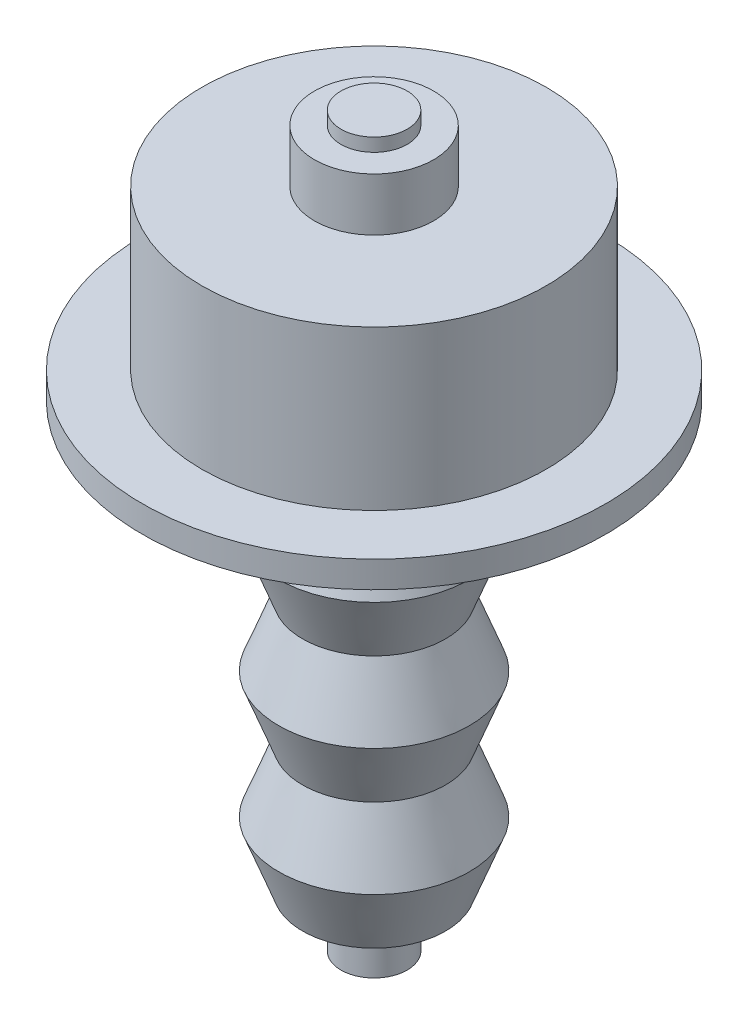
from build123d import *

# Parameters (mm, degrees)
SK_P02_GUIDEBOLTDROOPSTOP_R  = 2.5
P02_GUIDEBOLTDROOPSTOP_DEPTH = 55
P04_STOPNUT_START            = 50
SK_P04_STOPNUT_R             = 4.5
P04_STOPNUT_DEPTH            = 4


with BuildPart() as part:
    # SK_P01_Spring → P01_Spring (revolve)
    with BuildSketch(Plane.XY, mode=Mode.PRIVATE) as p01_spring_sk:
        Polygon((0, 4), (5.4, 4), (7.2, 8.778), (5.4, 13.556), (7.2, 18.333), (5.4, 23.111), (7.2, 27.889), (5.4, 32.667), (7.2, 37.444), (5.4, 42.222), (7.2, 47), (0, 47), align=None)
    revolve(p01_spring_sk.sketch.rotate(Axis((0, -1, 0), (0, 1, 0)), 90), axis=Axis((0, -1, 0), (0, 1, 0)))

    # SK_P02_Guideboltdroopstop → P02_Guideboltdroopstop (add)
    with BuildSketch(Plane(origin=(0, 0, 0), x_dir=(1, 0, 0), z_dir=(0, 1, 0))):
        with Locations(Location((0, 0, 0), (0, 0, 270))):
            Circle(SK_P02_GUIDEBOLTDROOPSTOP_R)
    extrude(amount=P02_GUIDEBOLTDROOPSTOP_DEPTH)

    # SK_P03_Springcup → P03_Springcup (revolve)
    with BuildSketch(Plane.XY, mode=Mode.PRIVATE) as p03_springcup_sk:
        Polygon((9.5, 36), (17.5, 36), (17.5, 38), (13, 38), (13, 50), (0, 50), (0, 47), (9.5, 47), align=None)
    revolve(p03_springcup_sk.sketch.rotate(Axis((0, 31, 0), (0, 1, 0)), 90), axis=Axis((0, 31, 0), (0, 1, 0)))

    # SK_P04_Stopnut → P04_Stopnut (add)
    with BuildSketch(Plane(origin=(0, 0, 0), x_dir=(1, 0, 0), z_dir=(0, 1, 0)).offset(P04_STOPNUT_START)):
        with Locations(Location((0, 0, 0), (0, 0, 270))):
            Circle(SK_P04_STOPNUT_R)
    extrude(amount=P04_STOPNUT_DEPTH)


solid = part.part
